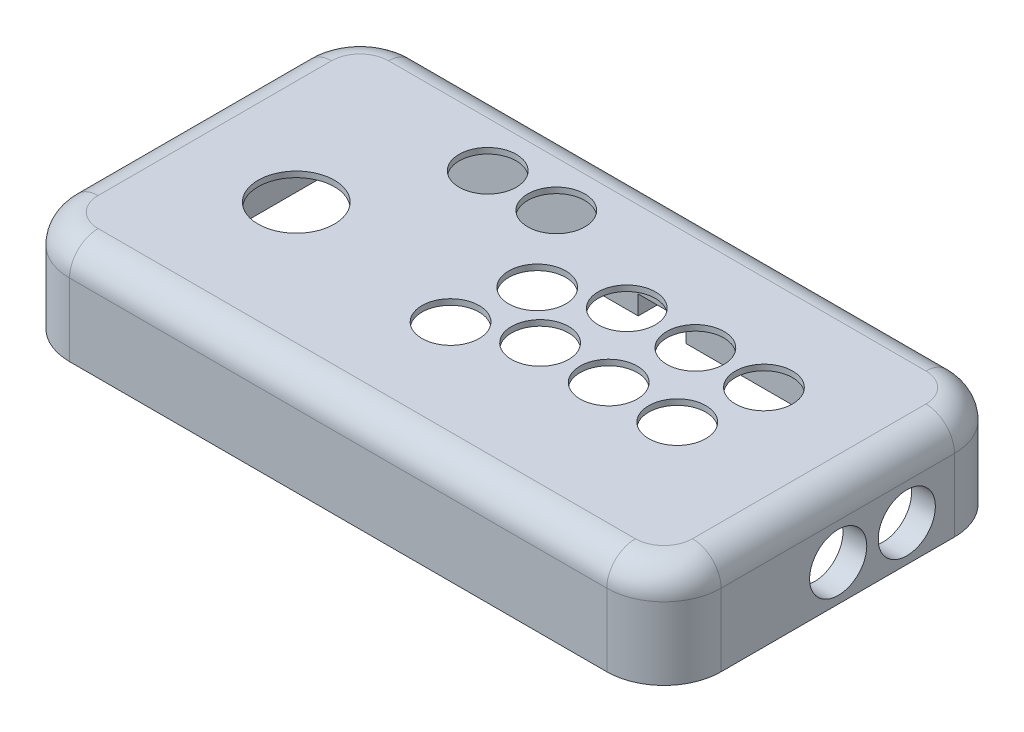
from build123d import *

# Parameters (mm, degrees)
SKETCH1_R           = 15
SKETCH1_R_2         = 20
BOSS_EXTRUDE2_DEPTH = 3
BOSS_EXTRUDE4_START = 50
BOSS_EXTRUDE4_DEPTH = 50
SKETCH4_W           = 25
SKETCH4_H           = 12.5
CUT_EXTRUDE1_DEPTH  = 10
FILLET1_R           = 15
SKETCH6_R           = 15
CUT_EXTRUDE2_DEPTH  = 40


with BuildPart() as part:
    # Sketch1 → Boss-Extrude2 (new body)
    with BuildSketch(Plane(origin=(0, 0, 0), x_dir=(1, 0, 0), z_dir=(0, 1, 0))):
        with BuildLine():
            Line((30, 0), (312, 0))
            ThreePointArc((312, 0), (333.213203436, 8.786796564), (342, 30))
            Line((342, 30), (342, 152.5))
            ThreePointArc((342, 152.5), (333.213203436, 173.713203436), (312, 182.5))
            Line((312, 182.5), (30, 182.5))
            ThreePointArc((30, 182.5), (8.786796564, 173.713203436), (0, 152.5))
            Line((0, 152.5), (0, 30))
            ThreePointArc((0, 30), (8.786796564, 8.786796564), (30, 0))
        make_face()
        with Locations(Location((165, 65, 0), (0, 0, 270))):
            Circle(SKETCH1_R, mode=Mode.SUBTRACT)
        with Locations(Location((172, 103.5, 0), (0, 0, 270))):
            Circle(SKETCH1_R, mode=Mode.SUBTRACT)
        with Locations(Location((198, 79, 0), (0, 0, 270))):
            Circle(SKETCH1_R, mode=Mode.SUBTRACT)
        with Locations(Location((205, 117.5, 0), (0, 0, 270))):
            Circle(SKETCH1_R, mode=Mode.SUBTRACT)
        with Locations(Location((234, 79, 0), (0, 0, 270))):
            Circle(SKETCH1_R, mode=Mode.SUBTRACT)
        with Locations(Location((241, 117.5, 0), (0, 0, 270))):
            Circle(SKETCH1_R, mode=Mode.SUBTRACT)
        with Locations(Location((270, 79, 0), (0, 0, 270))):
            Circle(SKETCH1_R, mode=Mode.SUBTRACT)
        with Locations(Location((277, 117.5, 0), (0, 0, 270))):
            Circle(SKETCH1_R, mode=Mode.SUBTRACT)
        with Locations(Location((70, 79, 0), (0, 0, 270))):
            Circle(SKETCH1_R_2, mode=Mode.SUBTRACT)
        with Locations(Location((106, 143.5, 0), (0, 0, 270))):
            Circle(SKETCH1_R, mode=Mode.SUBTRACT)
        with Locations(Location((142, 143.5, 0), (0, 0, 270))):
            Circle(SKETCH1_R, mode=Mode.SUBTRACT)
    extrude(amount=BOSS_EXTRUDE2_DEPTH)

    # Sketch2 → Boss-Extrude4 (add)
    with BuildSketch(Plane.XZ.offset(BOSS_EXTRUDE4_START)):
        with BuildLine():
            Line((30, 0), (312, 0))
            ThreePointArc((312, 0), (333.213203436, -8.786796564), (342, -30))
            Line((342, -30), (342, -152.5))
            ThreePointArc((342, -152.5), (333.213203436, -173.713203436), (312, -182.5))
            Line((312, -182.5), (30, -182.5))
            ThreePointArc((30, -182.5), (8.786796564, -173.713203436), (0, -152.5))
            Line((0, -152.5), (0, -30))
            ThreePointArc((0, -30), (8.786796564, -8.786796564), (30, 0))
        make_face()
        with BuildLine():
            Line((12.5, -30), (12.5, -152.5))
            ThreePointArc((12.5, -152.5), (17.625631329, -164.874368671), (30, -170))
            Line((30, -170), (312, -170))
            ThreePointArc((312, -170), (324.374368671, -164.874368671), (329.5, -152.5))
            Line((329.5, -152.5), (329.5, -30))
            ThreePointArc((329.5, -30), (324.374368671, -17.625631329), (312, -12.5))
            Line((312, -12.5), (30, -12.5))
            ThreePointArc((30, -12.5), (17.625631329, -17.625631329), (12.5, -30))
        make_face(mode=Mode.SUBTRACT)
    extrude(amount=-BOSS_EXTRUDE4_DEPTH)

    # Sketch4 → Cut-Extrude1 (cut)
    with BuildSketch(Plane.XZ.offset(50)):
        with Locations((171, -176.25)):
            Rectangle(SKETCH4_W, SKETCH4_H)
    extrude(amount=-CUT_EXTRUDE1_DEPTH, mode=Mode.SUBTRACT)

    # Fillet1
    fillet1_edges = [part.edges().sort_by_distance(p)[0] for p in [
        (8.786796564, 3, -8.786796564),
        (171, 3, 0),
        (333.213203436, 3, -8.786796564),
        (342, 3, -91.25),
        (333.213203436, 3, -173.713203436),
        (171, 3, -182.5),
        (8.786796564, 3, -173.713203436),
        (0, 3, -91.25),
    ]]
    fillet(fillet1_edges, radius=FILLET1_R)

    # Sketch6 → Cut-Extrude2 (cut)
    with BuildSketch(Plane(origin=(342, 0, 0), x_dir=(0, 0, -1), z_dir=(1, 0, 0))):
        with Locations((127.466870265, -31)):
            Circle(SKETCH6_R)
        with Locations((91.466870265, -31)):
            Circle(SKETCH6_R)
    extrude(amount=-CUT_EXTRUDE2_DEPTH, mode=Mode.SUBTRACT)


solid = part.part
